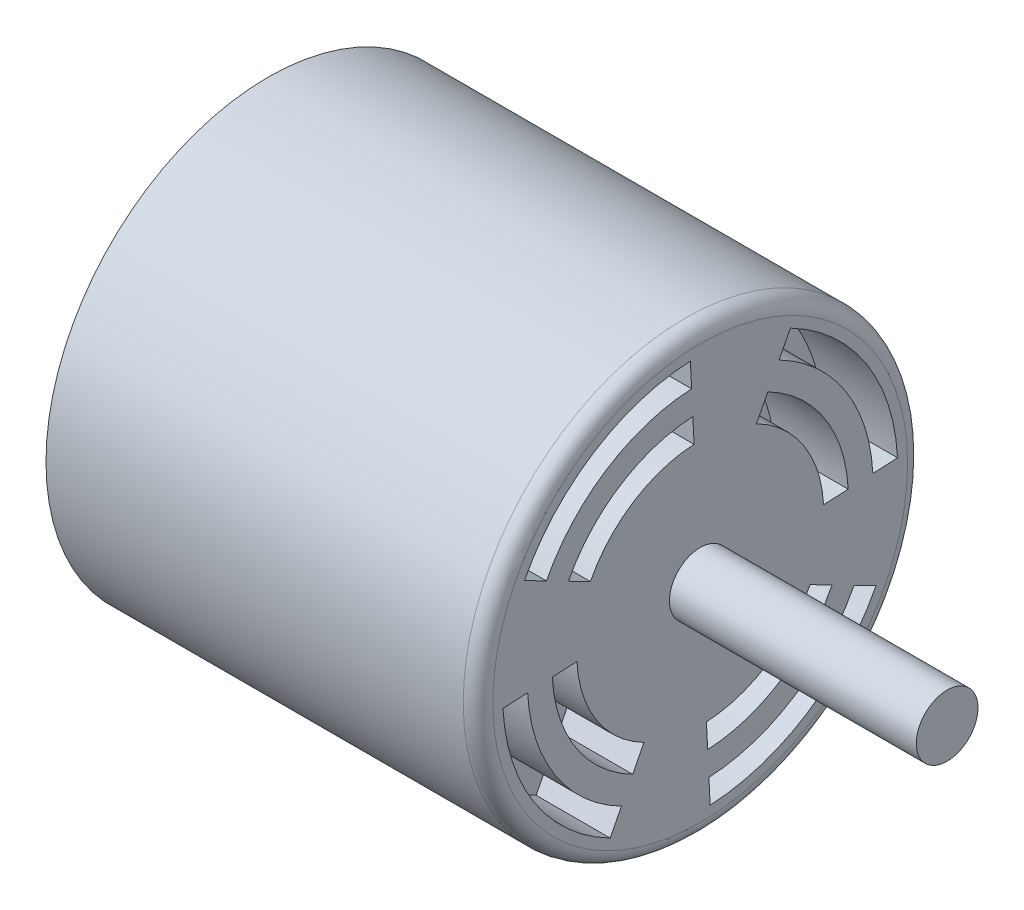
from build123d import *

# Parameters (mm, degrees)
SKETCH1_R           = 22.86
BOSS_EXTRUDE1_DEPTH = 44.45
SKETCH2_R           = 3.175
BOSS_EXTRUDE2_DEPTH = 25.4
CUT_EXTRUDE1_DEPTH  = 7.62
FILLET1_R           = 1.524


with BuildPart() as part:
    # Sketch1 → Boss-Extrude1 (new body)
    with BuildSketch(Plane.YZ):
        with Locations(Location((0, 0, 0), (0, 0, 270))):
            Circle(SKETCH1_R)
    extrude(amount=BOSS_EXTRUDE1_DEPTH)

    # Sketch2 → Boss-Extrude2 (add)
    with BuildSketch(Plane.YZ.offset(44.45)):
        with Locations(Location((0, 0, 0), (0, 0, 270))):
            Circle(SKETCH2_R)
    extrude(amount=BOSS_EXTRUDE2_DEPTH)

    # Sketch3 → Cut-Extrude1 (cut)
    with BuildSketch(Plane.YZ.offset(44.45)):
        with BuildLine():
            Line((12.684056828, 0.636162231), (15.220868194, 0.763394677))
            ThreePointArc((15.220868194, 0.763394677), (12.799961185, 8.27155328), (6.949314913, 13.563355862))
            Line((6.949314913, 13.563355862), (5.791095761, 11.302796551))
            ThreePointArc((5.791095761, 11.302796551), (10.666634321, 6.892961067), (12.684056828, 0.636162231))
        make_face()
        with BuildLine():
            Line((17.757679559, 0.890627123), (20.294490925, 1.017859569))
            ThreePointArc((20.294490925, 1.017859569), (17.066614913, 11.028737707), (9.265753218, 18.084474482))
            Line((9.265753218, 18.084474482), (8.107534066, 15.823915172))
            ThreePointArc((8.107534066, 15.823915172), (14.933288049, 9.650145494), (17.757679559, 0.890627123))
        make_face()
        with BuildLine():
            Line((15.823915172, -8.107534066), (18.084474482, -9.265753218))
            ThreePointArc((18.084474482, -9.265753218), (11.028737707, -17.066614913), (1.017859569, -20.294490925))
            Line((1.017859569, -20.294490925), (0.890627123, -17.757679559))
            ThreePointArc((0.890627123, -17.757679559), (9.650145494, -14.933288049), (15.823915172, -8.107534066))
        make_face()
        with BuildLine():
            Line((11.302796551, -5.791095761), (13.563355862, -6.949314913))
            ThreePointArc((13.563355862, -6.949314913), (8.27155328, -12.799961185), (0.763394677, -15.220868194))
            Line((0.763394677, -15.220868194), (0.636162231, -12.684056828))
            ThreePointArc((0.636162231, -12.684056828), (6.892961067, -10.666634321), (11.302796551, -5.791095761))
        make_face()
        with BuildLine():
            Line((-8.107534066, -15.823915172), (-9.265753218, -18.084474482))
            ThreePointArc((-9.265753218, -18.084474482), (-17.066614913, -11.028737707), (-20.294490925, -1.017859569))
            Line((-20.294490925, -1.017859569), (-17.757679559, -0.890627123))
            ThreePointArc((-17.757679559, -0.890627123), (-14.933288049, -9.650145494), (-8.107534066, -15.823915172))
        make_face()
        with BuildLine():
            Line((-5.791095761, -11.302796551), (-6.949314913, -13.563355862))
            ThreePointArc((-6.949314913, -13.563355862), (-12.799961185, -8.27155328), (-15.220868194, -0.763394677))
            Line((-15.220868194, -0.763394677), (-12.684056828, -0.636162231))
            ThreePointArc((-12.684056828, -0.636162231), (-10.666634321, -6.892961067), (-5.791095761, -11.302796551))
        make_face()
        with BuildLine():
            Line((-15.823915172, 8.107534066), (-18.084474482, 9.265753218))
            ThreePointArc((-18.084474482, 9.265753218), (-11.028737707, 17.066614913), (-1.017859569, 20.294490925))
            Line((-1.017859569, 20.294490925), (-0.890627123, 17.757679559))
            ThreePointArc((-0.890627123, 17.757679559), (-9.650145494, 14.933288049), (-15.823915172, 8.107534066))
        make_face()
        with BuildLine():
            Line((-11.302796551, 5.791095761), (-13.563355862, 6.949314913))
            ThreePointArc((-13.563355862, 6.949314913), (-8.27155328, 12.799961185), (-0.763394677, 15.220868194))
            Line((-0.763394677, 15.220868194), (-0.636162231, 12.684056828))
            ThreePointArc((-0.636162231, 12.684056828), (-6.892961067, 10.666634321), (-11.302796551, 5.791095761))
        make_face()
    extrude(amount=-CUT_EXTRUDE1_DEPTH, mode=Mode.SUBTRACT)

    # Fillet1
    fillet1_edges = [part.edges().sort_by_distance(p)[0] for p in [
        (44.45, 0, 22.86),
    ]]
    fillet(fillet1_edges, radius=FILLET1_R)


solid = part.part
